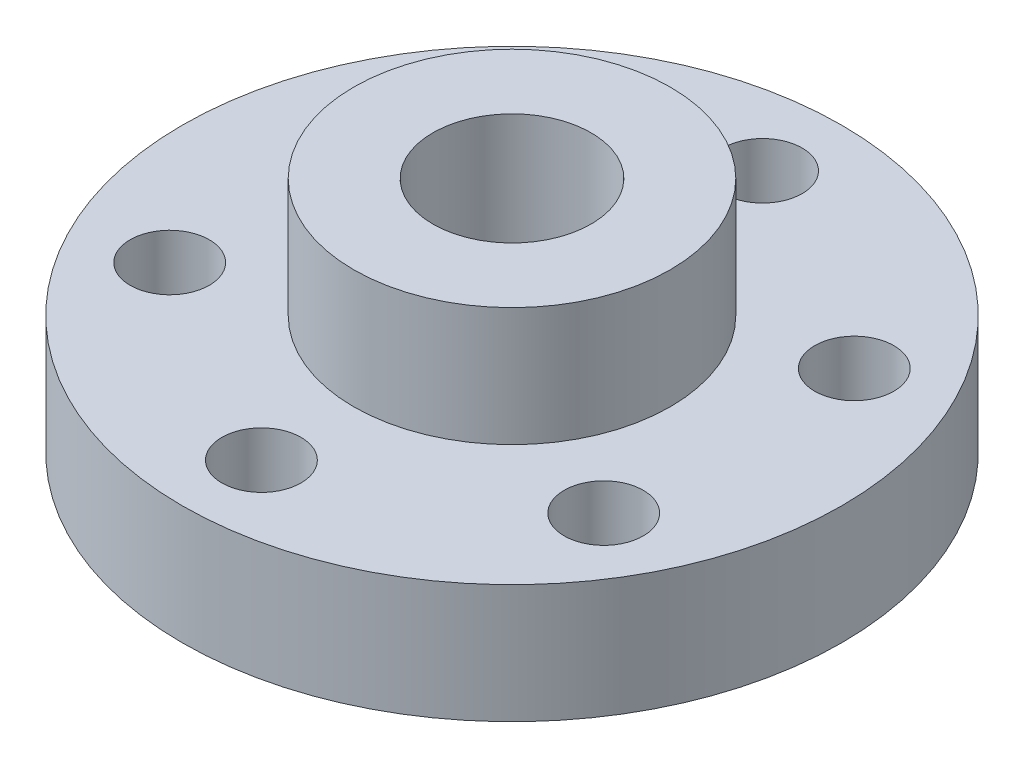
from build123d import *

# Parameters (mm, degrees)
SKETCH1_R           = 12.5
SKETCH1_R_2         = 6
SKETCH1_R_3         = 1.5
SKETCH1_R_4         = 3
BOSS_EXTRUDE1_DEPTH = 4.5
BOSS_EXTRUDE2_START = 4.5
SKETCH1_3_R         = 6
SKETCH1_3_R_2       = 3
BOSS_EXTRUDE2_DEPTH = 4.5


with BuildPart() as part:
    # Sketch1 → Boss-Extrude1 (new body)
    # profile 1 of 2: a face of its own
    with BuildSketch(Plane(origin=(0, 0, 0), x_dir=(1, 0, 0), z_dir=(0, 1, 0))):
        with Locations(Location((0, 0, 0), (0, 0, 270))):
            Circle(SKETCH1_R)
        Circle(SKETCH1_R_2, mode=Mode.SUBTRACT)
        with Locations(Location((-8.227241336, 4.75, 0), (0, 0, 270))):
            Circle(SKETCH1_R_3, mode=Mode.SUBTRACT)
        with Locations(Location((-8.227241336, -4.75, 0), (0, 0, 270))):
            Circle(SKETCH1_R_3, mode=Mode.SUBTRACT)
        with Locations(Location((0, -9.5, 0), (0, 0, 270))):
            Circle(SKETCH1_R_3, mode=Mode.SUBTRACT)
        with Locations(Location((8.227241336, -4.75, 0), (0, 0, 270))):
            Circle(SKETCH1_R_3, mode=Mode.SUBTRACT)
        with Locations(Location((8.227241336, 4.75, 0), (0, 0, 270))):
            Circle(SKETCH1_R_3, mode=Mode.SUBTRACT)
        with Locations(Location((0, 9.5, 0), (0, 0, 270))):
            Circle(SKETCH1_R_3, mode=Mode.SUBTRACT)
    # profile 2 of 2: a face of its own
    with BuildSketch(Plane(origin=(0, 0, 0), x_dir=(1, 0, 0), z_dir=(0, 1, 0))):
        Circle(SKETCH1_R_2)
        with Locations(Location((0, 0, 0), (0, 0, 270))):
            Circle(SKETCH1_R_4, mode=Mode.SUBTRACT)
    extrude(amount=BOSS_EXTRUDE1_DEPTH)

    # Sketch1<3> → Boss-Extrude2 (add)
    with BuildSketch(Plane(origin=(0, 0, 0), x_dir=(1, 0, 0), z_dir=(0, 1, 0)).offset(BOSS_EXTRUDE2_START)):
        with Locations(Location((0, 0, 0), (0, 0, 270))):
            Circle(SKETCH1_3_R)
        with Locations(Location((0, 0, 0), (0, 0, 270))):
            Circle(SKETCH1_3_R_2, mode=Mode.SUBTRACT)
    extrude(amount=BOSS_EXTRUDE2_DEPTH)


solid = part.part
